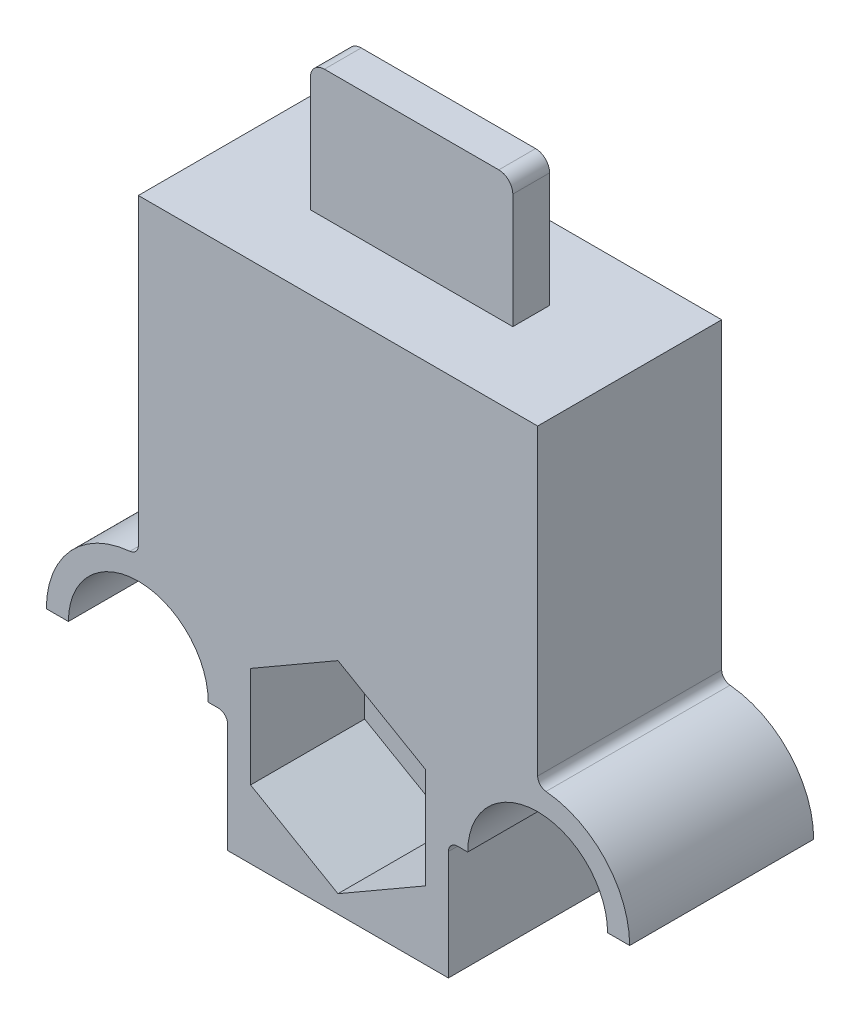
from build123d import *

# Parameters (mm, degrees)
SKETCH2_R           = 2.5
BOSS_EXTRUDE1_DEPTH = 10
CUT_EXTRUDE1_DEPTH  = 6.2
SKETCH4_W           = 11
SKETCH4_H           = 2
BOSS_EXTRUDE2_DEPTH = 7
FILLET1_R           = 0.762


with BuildPart() as part:
    # Sketch2 → Boss-Extrude1 (new body)
    with BuildSketch(Plane.XY.offset(-3838.451709017)):
        with BuildLine():
            Line((13.5, -20), (12.95, -20))
            ThreePointArc((12.95, -20), (9.15, -16.2), (5.35, -20))
            Line((5.35, -20), (4.15, -20))
            ThreePointArc((4.15, -20), (5.457255271, -16.629000688), (8.695454545, -15.020704023))
            ThreePointArc((8.695454545, -15.020704023), (9.019274473, -14.859874356), (9.15, -14.522774425))
            Line((9.15, -14.522774425), (9.15, 1.95))
            Line((9.15, 1.95), (30.85, 1.95))
            Line((30.85, 1.95), (30.85, -14.522774425))
            ThreePointArc((30.85, -14.522774425), (30.980725527, -14.859874356), (31.304545455, -15.020704023))
            ThreePointArc((31.304545455, -15.020704023), (34.542744729, -16.629000688), (35.85, -20))
            Line((35.85, -20), (34.65, -20))
            ThreePointArc((34.65, -20), (30.85, -16.2), (27.05, -20))
            Line((27.05, -20), (26.5, -20))
            ThreePointArc((26.5, -20), (26.146446609, -20.146446609), (26, -20.5))
            Line((26, -20.5), (26, -26.452543058))
            Line((26, -26.452543058), (20, -26.452543058))
            Line((20, -26.452543058), (14, -26.452543058))
            Line((14, -26.452543058), (14, -20.5))
            ThreePointArc((14, -20.5), (13.853553391, -20.146446609), (13.5, -20))
        make_face()
        with Locations((20, -20)):
            Circle(SKETCH2_R, mode=Mode.SUBTRACT)
    extrude(amount=BOSS_EXTRUDE1_DEPTH)

    # Sketch3 → Cut-Extrude1 (cut)
    with BuildSketch(Plane.XY.offset(-3828.451709017)):
        Polygon((20, -25.484827557), (24.75, -22.742413779), (24.75, -17.257586221), (20, -14.515172443), (15.25, -17.257586221), (15.25, -22.742413779), align=None)
    extrude(amount=-CUT_EXTRUDE1_DEPTH, mode=Mode.SUBTRACT)

    # Sketch4 → Boss-Extrude2 (add)
    with BuildSketch(Plane(origin=(0, 1.95, 0), x_dir=(1, 0, 0), z_dir=(0, 1, 0))):
        with Locations((20, 3833.451709017)):
            Rectangle(SKETCH4_W, SKETCH4_H)
    extrude(amount=BOSS_EXTRUDE2_DEPTH)

    # Fillet1
    fillet1_edges = [part.edges().sort_by_distance(p)[0] for p in [
        (25.5, 8.95, -3833.451709017),
        (14.5, 8.95, -3833.451709017),
    ]]
    fillet(fillet1_edges, radius=FILLET1_R)


solid = part.part
